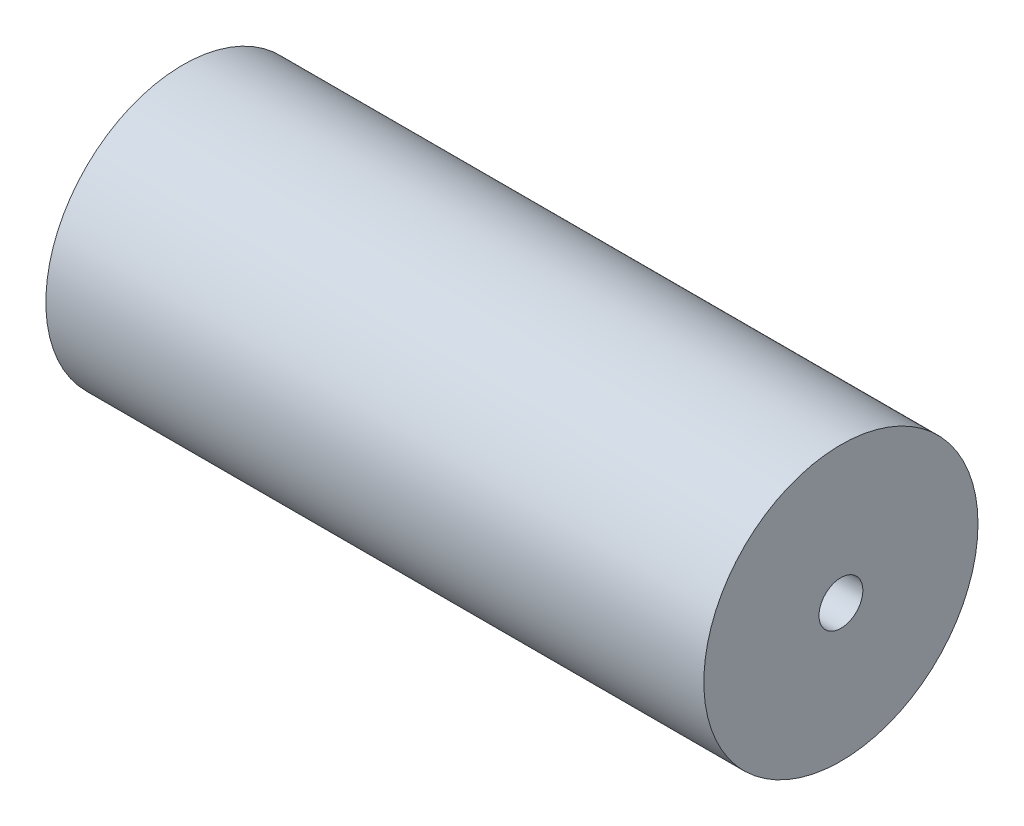
from build123d import *

# Parameters (mm, degrees)
SKETCH1_R           = 25
BOSS_EXTRUDE1_DEPTH = 60
SKETCH2_R           = 4
CUT_EXTRUDE1_DEPTH  = 126.099960032


with BuildPart() as part:
    # Sketch1 → Boss-Extrude1 (new, symmetric)
    with BuildSketch(Plane(origin=(0, 0, 0), x_dir=(0, 0, -1), z_dir=(1, 0, 0))):
        Circle(SKETCH1_R)
    extrude(amount=BOSS_EXTRUDE1_DEPTH, both=True)

    # Sketch2 → Cut-Extrude1 (cut, through all)
    with BuildSketch(Plane(origin=(60, 0, 0), x_dir=(0, 0, -1), z_dir=(1, 0, 0))):
        Circle(SKETCH2_R)
    extrude(amount=-CUT_EXTRUDE1_DEPTH, mode=Mode.SUBTRACT)


solid = part.part
